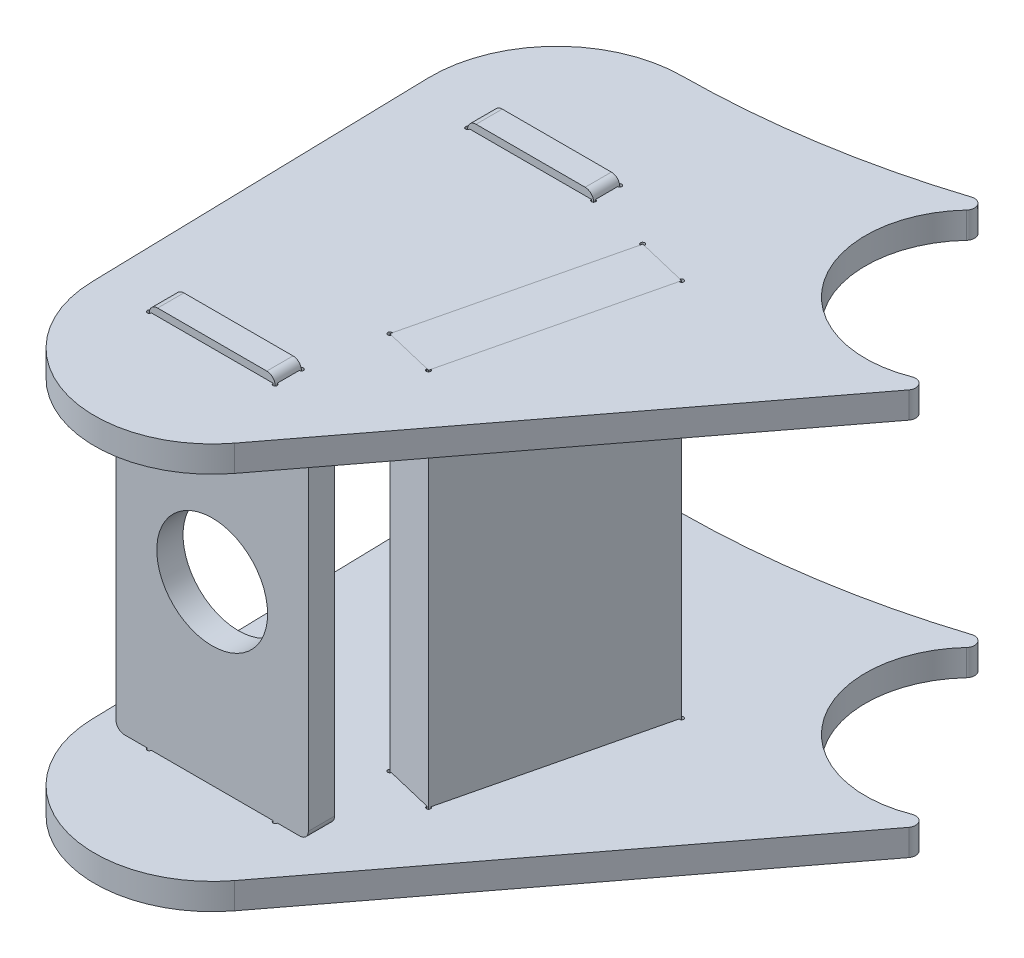
from build123d import *

# Parameters (mm, degrees)
SKETCH2_R           = 6.6
BOSS_EXTRUDE1_DEPTH = 3.125
BOSS_EXTRUDE2_DEPTH = 3.125
BOSS_EXTRUDE3_DEPTH = 48.25


with BuildPart() as part:
    # Sketch2 → Boss-Extrude1 (new body)
    with BuildSketch(Plane.XY.offset(17.4)):
        with BuildLine():
            Line((-10.454203197, 21), (-8.5, 21))
            ThreePointArc((-8.5, 21), (-7.792893219, 21.292893219), (-7.5, 22))
            Line((-7.5, 22), (-7.5, 24))
            ThreePointArc((-7.5, 24), (-7.207106781, 24.707106781), (-6.5, 25))
            Line((-6.5, 25), (6.5, 25))
            ThreePointArc((6.5, 25), (7.207106781, 24.707106781), (7.5, 24))
            Line((7.5, 24), (7.5, 22))
            ThreePointArc((7.5, 22), (7.792893219, 21.292893219), (8.5, 21))
            Line((8.5, 21), (10.454203197, 21))
            ThreePointArc((10.454203197, 21), (11.161309978, 20.707106781), (11.454203197, 20))
            Line((11.454203197, 20), (11.454203197, -20))
            ThreePointArc((11.454203197, -20), (11.161309978, -20.707106781), (10.454203197, -21))
            Line((10.454203197, -21), (8.5, -21))
            ThreePointArc((8.5, -21), (7.792893219, -21.292893219), (7.5, -22))
            Line((7.5, -22), (7.5, -24))
            ThreePointArc((7.5, -24), (7.207106781, -24.707106781), (6.5, -25))
            Line((6.5, -25), (-6.5, -25))
            ThreePointArc((-6.5, -25), (-7.207106781, -24.707106781), (-7.5, -24))
            Line((-7.5, -24), (-7.5, -22))
            ThreePointArc((-7.5, -22), (-7.792893219, -21.292893219), (-8.5, -21))
            Line((-8.5, -21), (-10.454203197, -21))
            ThreePointArc((-10.454203197, -21), (-11.161309978, -20.707106781), (-11.454203197, -20))
            Line((-11.454203197, -20), (-11.454203197, 20))
            ThreePointArc((-11.454203197, 20), (-11.161309978, 20.707106781), (-10.454203197, 21))
        make_face()
        Circle(SKETCH2_R, mode=Mode.SUBTRACT)
    extrude(amount=BOSS_EXTRUDE1_DEPTH)


with BuildPart() as body_2:
    # Mirror4: mirrored copy
    add(part.part.mirror(Plane.XY))


with BuildPart() as body_3:
    # Sketch3 → Boss-Extrude2 (new body)
    with BuildSketch(Plane(origin=(0, 21, 0), x_dir=(1, 0, 0), z_dir=(0, 1, 0))):
        with BuildLine():
            Line((-14.995548572, 20.159591961), (-13.995845334, -20.866047503))
            ThreePointArc((-13.995845334, -20.866047503), (-4.304899455, -33.846705622), (11.149602135, -28.991780512))
            Line((11.149602135, -28.991780512), (45.803836797, 16.643148633))
            ThreePointArc((45.803836797, 16.643148633), (45.804881318, 17.851310743), (44.64193032, 18.178727526))
            ThreePointArc((44.64193032, 18.178727526), (29.506490967, 22.846240976), (30.692443483, 38.64056663))
            ThreePointArc((30.692443483, 38.64056663), (30.803607848, 39.857201974), (29.654988423, 40.273414054))
            ThreePointArc((29.654988423, 40.273414054), (14.955060827, 36.771533486), (-0.104696211, 35.524634619))
            ThreePointArc((-0.104696211, 35.524634619), (-10.771512526, 30.964086066), (-14.995548572, 20.159591961))
        make_face()
        with BuildLine():
            Line((-7.25, 17.4), (7.25, 17.4))
            ThreePointArc((7.25, 17.4), (7.676776695, 17.223223305), (7.5, 17.65))
            Line((7.5, 17.65), (7.5, 20.275))
            ThreePointArc((7.5, 20.275), (7.676776695, 20.701776695), (7.25, 20.525))
            Line((7.25, 20.525), (-7.25, 20.525))
            ThreePointArc((-7.25, 20.525), (-7.676776695, 20.701776695), (-7.5, 20.275))
            Line((-7.5, 20.275), (-7.5, 17.65))
            ThreePointArc((-7.5, 17.65), (-7.676776695, 17.223223305), (-7.25, 17.4))
        make_face(mode=Mode.SUBTRACT)
        with BuildLine():
            Line((-7.5, -17.65), (-7.5, -20.275))
            ThreePointArc((-7.5, -20.275), (-7.676776695, -20.701776695), (-7.25, -20.525))
            Line((-7.25, -20.525), (7.25, -20.525))
            ThreePointArc((7.25, -20.525), (7.676776695, -20.701776695), (7.5, -20.275))
            Line((7.5, -20.275), (7.5, -17.65))
            ThreePointArc((7.5, -17.65), (7.676776695, -17.223223305), (7.25, -17.4))
            Line((7.25, -17.4), (-7.25, -17.4))
            ThreePointArc((-7.25, -17.4), (-7.676776695, -17.223223305), (-7.5, -17.65))
        make_face(mode=Mode.SUBTRACT)
        with BuildLine():
            Line((14.87736729, 15.601711403), (9.150468269, -8.222602563))
            ThreePointArc((9.150468269, -8.222602563), (8.878840307, -8.596242226), (9.335113421, -8.524109061))
            Line((9.335113421, -8.524109061), (14.925857384, -9.868014542))
            ThreePointArc((14.925857384, -9.868014542), (15.299497047, -10.139642504), (15.227363881, -9.683369391))
            Line((15.227363881, -9.683369391), (20.953569845, 14.138061407))
            ThreePointArc((20.953569845, 14.138061407), (21.225197807, 14.51170107), (20.768924694, 14.439567905))
            Line((20.768924694, 14.439567905), (15.140853204, 15.792446193))
            ThreePointArc((15.140853204, 15.792446193), (14.75118288, 16.053386255), (14.87736729, 15.601711403))
        make_face(mode=Mode.SUBTRACT)
    extrude(amount=BOSS_EXTRUDE2_DEPTH)


with BuildPart() as body_4:
    # Mirror5: mirrored copy
    add(body_3.part.mirror(Plane.ZX))


with BuildPart() as body_5:
    # Sketch4 → Boss-Extrude3 (new body)
    with BuildSketch(Plane(origin=(0, 24.125, 0), x_dir=(1, 0, 0), z_dir=(0, 1, 0))):
        Polygon((9.092037596, -8.465678388), (15.168933208, -9.926445215), (21.012000518, 14.381137232), (14.935104906, 15.841904059), align=None)
    extrude(amount=-BOSS_EXTRUDE3_DEPTH)


solid = Compound([part.part, body_2.part, body_3.part, body_4.part, body_5.part])
